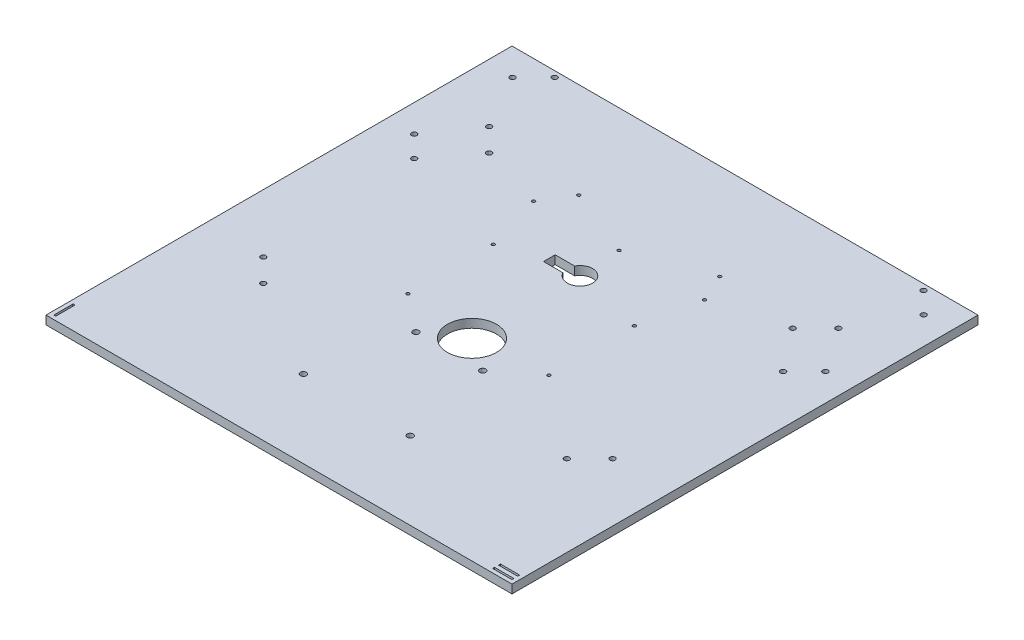
from build123d import *

# Parameters (mm, degrees)
SKETCH2_W           = 304.8
SKETCH2_H           = 304.8
BOSS_EXTRUDE1_DEPTH = 5.588
SKETCH4_W           = 1.27
SKETCH4_H           = 12.7
SKETCH4_W_2         = 12.7
SKETCH4_H_2         = 1.27
CUT_EXTRUDE1_DEPTH  = 432.088512656
SKETCH5_W           = 228.854
SKETCH5_H           = 12.954
CUT_EXTRUDE2_DEPTH  = 0.254
SKETCH6_R           = 16.002
SKETCH6_R_2         = 1.7
SKETCH6_R_3         = 1.96
CUT_EXTRUDE3_DEPTH  = 432.088512656
CUT_EXTRUDE4_DEPTH  = 432.088512656
SKETCH8_R           = 1.016
CUT_EXTRUDE5_DEPTH  = 432.088512656
SKETCH9_R           = 1.016
CUT_EXTRUDE6_DEPTH  = 432.088512656
BOSS_EXTRUDE3_REACH = 433.089
SKETCH10_W          = 236.011664121
SKETCH10_H          = 22.945578457


with BuildPart() as part:
    # Sketch2 → Boss-Extrude1 (new body)
    with BuildSketch(Plane(origin=(0, 0, 0), x_dir=(1, 0, 0), z_dir=(0, 1, 0))):
        with Locations((152.4, 152.4)):
            Rectangle(SKETCH2_W, SKETCH2_H)
    extrude(amount=BOSS_EXTRUDE1_DEPTH)

    # Sketch4 → Cut-Extrude1 (cut, through all)
    with BuildSketch(Plane(origin=(0, 5.588, 0), x_dir=(1, 0, 0), z_dir=(0, 1, 0))):
        with Locations((3.175, 8.89)):
            Rectangle(SKETCH4_W, SKETCH4_H)
        with Locations((295.91, 3.175)):
            Rectangle(SKETCH4_W_2, SKETCH4_H_2)
        with Locations((295.91, 6.985)):
            Rectangle(SKETCH4_W_2, SKETCH4_H_2)
    extrude(amount=-CUT_EXTRUDE1_DEPTH, mode=Mode.SUBTRACT)

    # Sketch5 → Cut-Extrude2 (cut)
    with BuildSketch(Plane(origin=(0, 5.588, 0), x_dir=(1, 0, 0), z_dir=(0, 1, 0))):
        with Locations((148.97354, 274.58924)):
            Rectangle(SKETCH5_W, SKETCH5_H)
    extrude(amount=-CUT_EXTRUDE2_DEPTH, mode=Mode.SUBTRACT)

    # Sketch6 → Cut-Extrude3 (cut, through all)
    with BuildSketch(Plane(origin=(0, 5.588, 0), x_dir=(1, 0, 0), z_dir=(0, 1, 0))):
        with Locations(Location((152.4799846, 126.1262654, 0), (0, 0, 270))):
            Circle(SKETCH6_R)
        with Locations(Location((31.75, 300.959132824, 0), (0, 0, 270))):
            Circle(SKETCH6_R_2)
        with Locations(Location((17.93875, 287.147882824, 0), (0, 0, 270))):
            Circle(SKETCH6_R_2)
        with Locations(Location((273.05, 300.959132824, 0), (0, 0, 270))):
            Circle(SKETCH6_R_2)
        with Locations(Location((286.86125, 287.147882824, 0), (0, 0, 270))):
            Circle(SKETCH6_R_2)
        with Locations(Location((286.86125, 222.906202824, 0), (0, 0, 270))):
            Circle(SKETCH6_R_2)
        with Locations(Location((273.05, 209.094952824, 0), (0, 0, 270))):
            Circle(SKETCH6_R_2)
        with Locations(Location((31.75, 209.094952824, 0), (0, 0, 270))):
            Circle(SKETCH6_R_2)
        with Locations(Location((17.93875, 222.906202824, 0), (0, 0, 270))):
            Circle(SKETCH6_R_2)
        with Locations(Location((38.1787654, 103.9330154, 0), (0, 0, 270))):
            Circle(SKETCH6_R_2)
        with Locations(Location((53.1330154, 88.9787654, 0), (0, 0, 270))):
            Circle(SKETCH6_R_2)
        with Locations(Location((251.6669846, 88.9787654, 0), (0, 0, 270))):
            Circle(SKETCH6_R_2)
        with Locations(Location((266.6212346, 103.9330154, 0), (0, 0, 270))):
            Circle(SKETCH6_R_2)
        with Locations(Location((266.6212346, 251.6669846, 0), (0, 0, 270))):
            Circle(SKETCH6_R_2)
        with Locations(Location((251.6669846, 236.7127346, 0), (0, 0, 270))):
            Circle(SKETCH6_R_2)
        with Locations(Location((53.1330154, 236.7127346, 0), (0, 0, 270))):
            Circle(SKETCH6_R_2)
        with Locations(Location((38.1787654, 251.6669846, 0), (0, 0, 270))):
            Circle(SKETCH6_R_2)
        with Locations(Location((130.6518596, 111.328047494, 0), (0, 0, 270))):
            Circle(SKETCH6_R_3)
        with Locations(Location((174.3081096, 111.328047494, 0), (0, 0, 270))):
            Circle(SKETCH6_R_3)
        with Locations(Location((187.4049846, 50.821596477, 0), (0, 0, 270))):
            Circle(SKETCH6_R_3)
        with Locations(Location((117.5549846, 50.821596477, 0), (0, 0, 270))):
            Circle(SKETCH6_R_3)
    extrude(amount=-CUT_EXTRUDE3_DEPTH, mode=Mode.SUBTRACT)

    # Sketch7 → Cut-Extrude4 (cut, through all)
    with BuildSketch(Plane(origin=(0, 5.588, 0), x_dir=(1, 0, 0), z_dir=(0, 1, 0))):
        with BuildLine():
            Line((145.076822752, 200.66), (132.376822752, 200.66))
            Line((132.376822752, 200.66), (132.376822752, 193.04))
            Line((132.376822752, 193.04), (145.076822752, 193.04))
            ThreePointArc((145.076822752, 193.04), (160.655, 196.85), (145.076822752, 200.66))
        make_face()
    extrude(amount=-CUT_EXTRUDE4_DEPTH, mode=Mode.SUBTRACT)

    # Sketch8 → Cut-Extrude5 (cut, through all)
    with BuildSketch(Plane(origin=(0, 5.588, 0), x_dir=(1, 0, 0), z_dir=(0, 1, 0))):
        with Locations(Location((206.6999846, 223.9950154, 0), (0, 0, 270))):
            Circle(SKETCH8_R)
        with Locations(Location((150.8199846, 223.9950154, 0), (0, 0, 270))):
            Circle(SKETCH8_R)
        with Locations(Location((94.9399846, 223.9950154, 0), (0, 0, 270))):
            Circle(SKETCH8_R)
    extrude(amount=-CUT_EXTRUDE5_DEPTH, mode=Mode.SUBTRACT)

    # Sketch9 → Cut-Extrude6 (cut, through all)
    with BuildSketch(Plane(origin=(0, 5.588, 0), x_dir=(1, 0, 0), z_dir=(0, 1, 0))):
        with Locations(Location((106.3, 242.18, 0), (0, 0, 270))):
            Circle(SKETCH9_R)
        with Locations(Location((106.3, 186.3, 0), (0, 0, 270))):
            Circle(SKETCH9_R)
        with Locations(Location((106.3, 130.42, 0), (0, 0, 270))):
            Circle(SKETCH9_R)
        with Locations(Location((198.5, 130.42, 0), (0, 0, 270))):
            Circle(SKETCH9_R)
        with Locations(Location((198.5, 186.3, 0), (0, 0, 270))):
            Circle(SKETCH9_R)
        with Locations(Location((198.5, 242.18, 0), (0, 0, 270))):
            Circle(SKETCH9_R)
    extrude(amount=-CUT_EXTRUDE6_DEPTH, mode=Mode.SUBTRACT)

    # Sketch10 → Boss-Extrude3 (add, up to next)
    with BuildSketch(Plane(origin=(0, 5.588, 0), x_dir=(1, 0, 0), z_dir=(0, 1, 0)), mode=Mode.PRIVATE) as boss_extrude3_sk1:
        with Locations((148.069627159, 275.695978824)):
            Rectangle(SKETCH10_W, SKETCH10_H)
    boss_extrude3_tool1 = extrude(boss_extrude3_sk1.sketch, amount=-BOSS_EXTRUDE3_REACH, mode=Mode.PRIVATE) - part.part
    add(boss_extrude3_tool1.solids().sort_by_distance((148.069627, 5.588, -275.695979))[0])


solid = part.part
